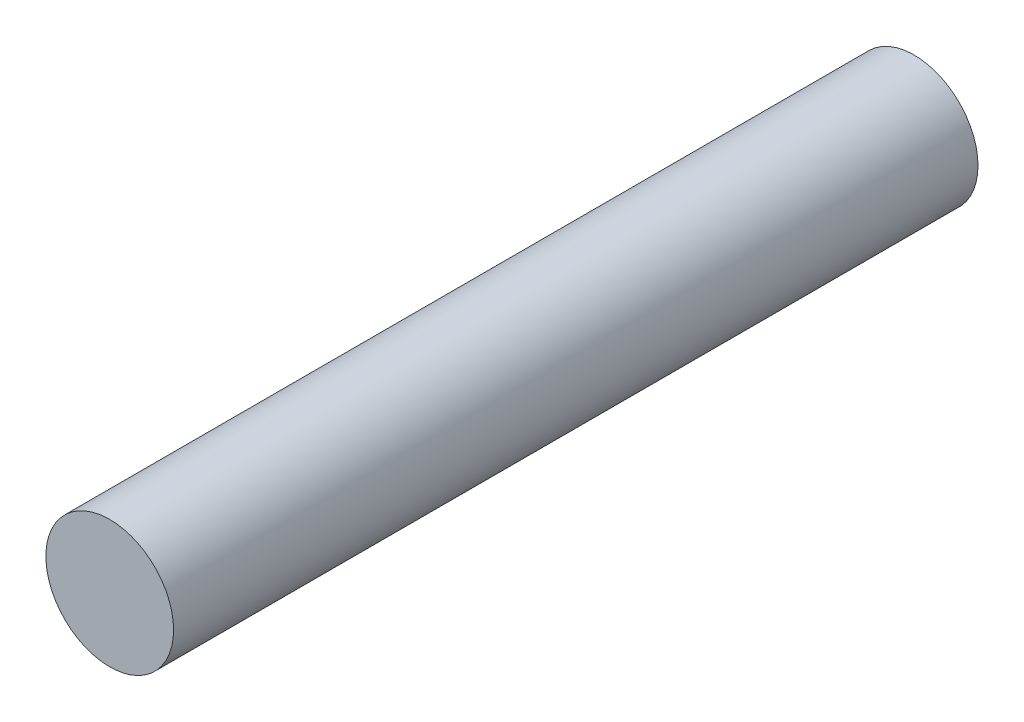
from build123d import *

# Parameters (mm, degrees)
SKETCH_1_R      = 1.5875
EXTRUDE_1_DEPTH = 20


with BuildPart() as part:
    # 草圖1 → 填料-伸長1 (new body)
    with BuildSketch(Plane.XY):
        Circle(SKETCH_1_R)
    extrude(amount=EXTRUDE_1_DEPTH)


solid = part.part
